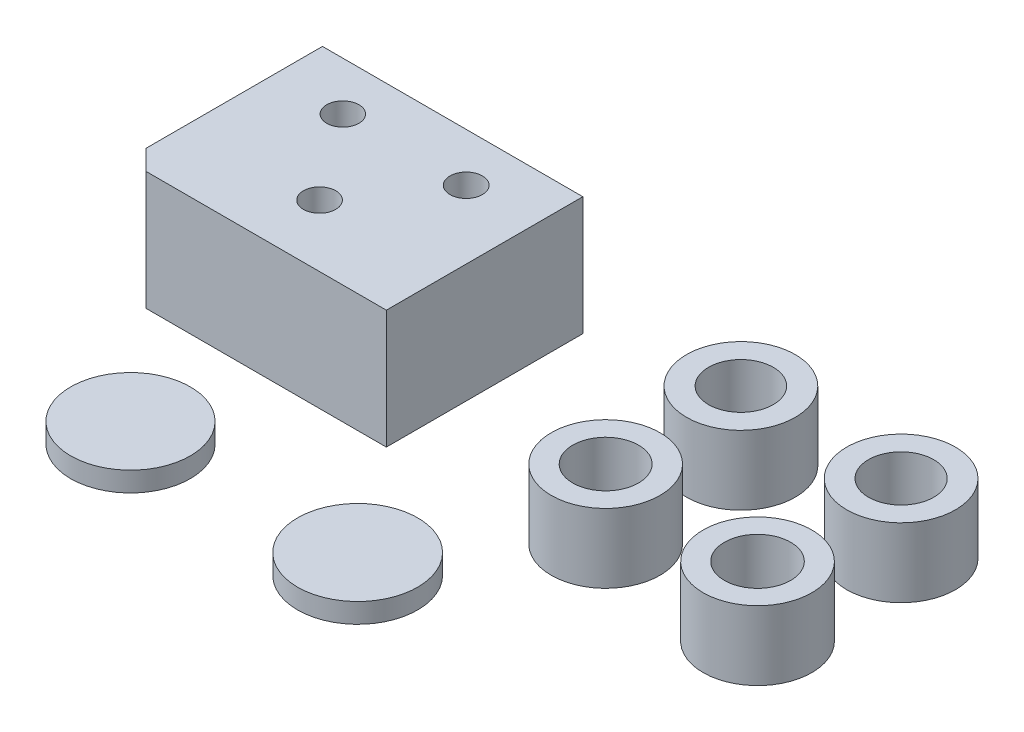
from build123d import *

# Parameters (mm, degrees)
SKETCH1_R             = 1.63
SKETCH1_R_2           = 1.635
SKETCH1_R_3           = 1.64
BOSS_EXTRUDE1_DEPTH   = 12
SKETCH2_R             = 5.5
SKETCH2_R_2           = 3.275
BOSS_EXTRUDE2_DEPTH   = 7
SKETCH2_R_3           = 3.3
BOSS_EXTRUDE2_2_DEPTH = 7
SKETCH2_R_4           = 3.325
BOSS_EXTRUDE2_3_DEPTH = 7
SKETCH2_R_5           = 3.35
BOSS_EXTRUDE2_4_DEPTH = 7
SKETCH3_R             = 6.05
BOSS_EXTRUDE3_DEPTH   = 2
SKETCH3_R_2           = 6.075
BOSS_EXTRUDE3_2_DEPTH = 2
CHAMFER1_SIZE         = 0.5
CHAMFER2_SIZE         = 0.5
CHAMFER3_SIZE         = 0.5
CHAMFER4_SIZE         = 0.5
CHAMFER5_SIZE         = 0.5


with BuildPart() as part:
    # Sketch1 → Boss-Extrude1 (new body)
    with BuildSketch(Plane(origin=(0, 0, 0), x_dir=(1, 0, 0), z_dir=(0, 1, 0))):
        Polygon((0, 2), (2, 0), (26.333228461, 0), (26.333228461, 19.872287649), (0, 19.872287649), align=None)
        with Locations(Location((6.950406025, 14.977635519, 0), (0, 0, 270))):
            Circle(SKETCH1_R, mode=Mode.SUBTRACT)
        with Locations(Location((13.313453795, 6.265154727, 0), (0, 0, 270))):
            Circle(SKETCH1_R_2, mode=Mode.SUBTRACT)
        with Locations(Location((19.431768957, 14.977635519, 0), (0, 0, 270))):
            Circle(SKETCH1_R_3, mode=Mode.SUBTRACT)
    extrude(amount=BOSS_EXTRUDE1_DEPTH)

    # Chamfer5
    chamfer5_edges = [part.edges().sort_by_distance(p)[0] for p in [
        (6.950406025, 0, -16.607635519),
        (13.313453795, 0, -7.900154727),
        (19.431768957, 0, -16.617635519),
    ]]
    chamfer(chamfer5_edges, length=CHAMFER5_SIZE)


with BuildPart() as body_2:
    # Sketch2 → Boss-Extrude2 (new body)
    with BuildSketch(Plane(origin=(0, 0, 0), x_dir=(1, 0, 0), z_dir=(0, 1, 0))):
        with Locations(Location((45.904915305, 16.290147447, 0), (0, 0, 270))):
            Circle(SKETCH2_R)
        with Locations(Location((45.904915305, 16.290147447, 0), (0, 0, 270))):
            Circle(SKETCH2_R_2, mode=Mode.SUBTRACT)
    extrude(amount=BOSS_EXTRUDE2_DEPTH)

    # Chamfer4
    chamfer4_edges = [body_2.edges().sort_by_distance(p)[0] for p in [
        (45.904915305, 0, -19.565147447),
    ]]
    chamfer(chamfer4_edges, length=CHAMFER4_SIZE)


with BuildPart() as body_3:
    # Sketch2 → Boss-Extrude2 2 (new body)
    with BuildSketch(Plane(origin=(0, 0, 0), x_dir=(1, 0, 0), z_dir=(0, 1, 0))):
        with Locations(Location((62.108845123, 16.290147447, 0), (0, 0, 270))):
            Circle(SKETCH2_R)
        with Locations(Location((62.108845123, 16.290147447, 0), (0, 0, 270))):
            Circle(SKETCH2_R_3, mode=Mode.SUBTRACT)
    extrude(amount=BOSS_EXTRUDE2_2_DEPTH)

    # Chamfer3
    chamfer3_edges = [body_3.edges().sort_by_distance(p)[0] for p in [
        (62.108845123, 0, -19.590147447),
    ]]
    chamfer(chamfer3_edges, length=CHAMFER3_SIZE)


with BuildPart() as body_4:
    # Sketch2 → Boss-Extrude2 3 (new body)
    with BuildSketch(Plane(origin=(0, 0, 0), x_dir=(1, 0, 0), z_dir=(0, 1, 0))):
        with Locations(Location((45.904915305, 2.60852746, 0), (0, 0, 270))):
            Circle(SKETCH2_R)
        with Locations(Location((45.904915305, 2.60852746, 0), (0, 0, 270))):
            Circle(SKETCH2_R_4, mode=Mode.SUBTRACT)
    extrude(amount=BOSS_EXTRUDE2_3_DEPTH)

    # Chamfer1
    chamfer1_edges = [body_4.edges().sort_by_distance(p)[0] for p in [
        (45.904915305, 0, -5.93352746),
    ]]
    chamfer(chamfer1_edges, length=CHAMFER1_SIZE)


with BuildPart() as body_5:
    # Sketch2 → Boss-Extrude2 4 (new body)
    with BuildSketch(Plane(origin=(0, 0, 0), x_dir=(1, 0, 0), z_dir=(0, 1, 0))):
        with Locations(Location((62.108845123, 1.767757517, 0), (0, 0, 270))):
            Circle(SKETCH2_R)
        with Locations(Location((62.108845123, 1.767757517, 0), (0, 0, 270))):
            Circle(SKETCH2_R_5, mode=Mode.SUBTRACT)
    extrude(amount=BOSS_EXTRUDE2_4_DEPTH)

    # Chamfer2
    chamfer2_edges = [body_5.edges().sort_by_distance(p)[0] for p in [
        (62.108845123, 0, -5.117757517),
    ]]
    chamfer(chamfer2_edges, length=CHAMFER2_SIZE)


with BuildPart() as body_6:
    # Sketch3 → Boss-Extrude3 (new body)
    with BuildSketch(Plane(origin=(0, 0, 0), x_dir=(1, 0, 0), z_dir=(0, 1, 0))):
        with Locations(Location((13.135466649, -12.680886102, 0), (0, 0, 270))):
            Circle(SKETCH3_R)
    extrude(amount=BOSS_EXTRUDE3_DEPTH)


with BuildPart() as body_7:
    # Sketch3 → Boss-Extrude3 2 (new body)
    with BuildSketch(Plane(origin=(0, 0, 0), x_dir=(1, 0, 0), z_dir=(0, 1, 0))):
        with Locations(Location((36.109234192, -12.680886102, 0), (0, 0, 270))):
            Circle(SKETCH3_R_2)
    extrude(amount=BOSS_EXTRUDE3_2_DEPTH)


solid = Compound([part.part, body_2.part, body_3.part, body_4.part, body_5.part, body_6.part, body_7.part])
